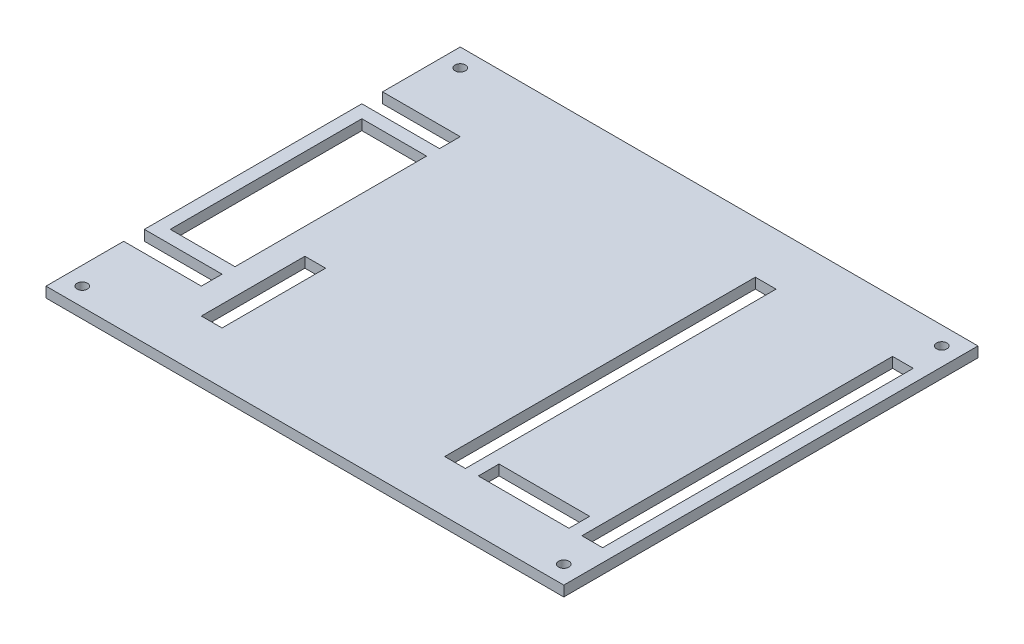
from build123d import *

# Parameters (mm, degrees)
SKETCH3_W               = 200
SKETCH3_H               = 160
BOSS_EXTRUDE1_DEPTH     = 4
SKETCH4_R               = 2
CUT_EXTRUDE1_DEPTH      = 129.124939024
CUT_EXTRUDE3_DEPTH      = 129.124939024
CUT_EXTRUDE3_DEPTH_BACK = 129.124939024
SKETCH5_W               = 30
SKETCH5_H               = 8
SKETCH7_W               = 25
SKETCH7_H               = 74
CUT_EXTRUDE4_DEPTH      = 129.124939024
CUT_EXTRUDE6_DEPTH      = 129.124939024
CUT_EXTRUDE6_DEPTH_BACK = 4
SKETCH12_W              = 8
SKETCH12_H              = 120
CUT_EXTRUDE8_DEPTH      = 129.124939024
SKETCH14_W              = 8
SKETCH14_H              = 120
CUT_EXTRUDE9_DEPTH      = 129.124939024
SKETCH15_W              = 8
SKETCH15_H              = 40
CUT_EXTRUDE10_DEPTH     = 129.124939024
SKETCH16_W              = 35
SKETCH16_H              = 8
CUT_EXTRUDE11_DEPTH     = 129.124939024


with BuildPart() as part:
    # Sketch3 → Boss-Extrude1 (new body)
    with BuildSketch(Plane(origin=(0, 0, 0), x_dir=(1, 0, 0), z_dir=(0, 1, 0))):
        Rectangle(SKETCH3_W, SKETCH3_H)
    extrude(amount=BOSS_EXTRUDE1_DEPTH)

    # Sketch4 → Cut-Extrude1 (cut, through all)
    with BuildSketch(Plane(origin=(0, 4, 0), x_dir=(1, 0, 0), z_dir=(0, 1, 0))):
        with Locations(Location((-93, 73, 0), (0, 0, 270))):
            Circle(SKETCH4_R)
        with Locations(Location((93, 73, 0), (0, 0, 270))):
            Circle(SKETCH4_R)
        with Locations(Location((-93, -73, 0), (0, 0, 270))):
            Circle(SKETCH4_R)
        with Locations(Location((93, -73, 0), (0, 0, 270))):
            Circle(SKETCH4_R)
    extrude(amount=-CUT_EXTRUDE1_DEPTH, mode=Mode.SUBTRACT)

    # Sketch5 → Cut-Extrude3 (cut, two sides: drawn at the far end of the back side and taken through both)
    with BuildSketch(Plane(origin=(0, 4, 0), x_dir=(1, 0, 0), z_dir=(0, 1, 0)).offset(-CUT_EXTRUDE3_DEPTH_BACK)):
        with Locations((-85, 46)):
            Rectangle(SKETCH5_W, SKETCH5_H)
    extrude(amount=CUT_EXTRUDE3_DEPTH + CUT_EXTRUDE3_DEPTH_BACK, mode=Mode.SUBTRACT)

    # Sketch7 → Cut-Extrude4 (cut, through all)
    with BuildSketch(Plane(origin=(0, 4, 0), x_dir=(1, 0, 0), z_dir=(0, 1, 0))):
        with Locations((-82.5, 0)):
            Rectangle(SKETCH7_W, SKETCH7_H)
    extrude(amount=-CUT_EXTRUDE4_DEPTH, mode=Mode.SUBTRACT)

    # Sketch11 → Cut-Extrude6 (cut, two sides: drawn at the far end of the back side and taken through both)
    with BuildSketch(Plane(origin=(0, 4, 0), x_dir=(1, 0, 0), z_dir=(0, 1, 0)).offset(-CUT_EXTRUDE6_DEPTH_BACK)):
        Polygon((-587.074417675, -42), (-100, -42), (-70, -42), (-70, -50), (-100, -50), (-587.074417675, -50), (-1561.223253025, -50), (-1561.223253025, -42), align=None)
    extrude(amount=CUT_EXTRUDE6_DEPTH + CUT_EXTRUDE6_DEPTH_BACK, mode=Mode.SUBTRACT)

    # Sketch12 → Cut-Extrude8 (cut, through all)
    with BuildSketch(Plane(origin=(0, 4, 0), x_dir=(1, 0, 0), z_dir=(0, 1, 0))):
        with Locations((91, 0)):
            Rectangle(SKETCH12_W, SKETCH12_H)
    extrude(amount=-CUT_EXTRUDE8_DEPTH, mode=Mode.SUBTRACT)

    # Sketch14 → Cut-Extrude9 (cut, through all)
    with BuildSketch(Plane(origin=(0, 4, 0), x_dir=(1, 0, 0), z_dir=(0, 1, 0))):
        with Locations((38, 0)):
            Rectangle(SKETCH14_W, SKETCH14_H)
    extrude(amount=-CUT_EXTRUDE9_DEPTH, mode=Mode.SUBTRACT)

    # Sketch15 → Cut-Extrude10 (cut, through all)
    with BuildSketch(Plane(origin=(0, 4, 0), x_dir=(1, 0, 0), z_dir=(0, 1, 0))):
        with Locations((-56, -40)):
            Rectangle(SKETCH15_W, SKETCH15_H)
    extrude(amount=-CUT_EXTRUDE10_DEPTH, mode=Mode.SUBTRACT)

    # Sketch16 → Cut-Extrude11 (cut, through all)
    with BuildSketch(Plane(origin=(0, 4, 0), x_dir=(1, 0, 0), z_dir=(0, 1, 0))):
        with Locations((64.5, -56)):
            Rectangle(SKETCH16_W, SKETCH16_H)
    extrude(amount=-CUT_EXTRUDE11_DEPTH, mode=Mode.SUBTRACT)


solid = part.part
